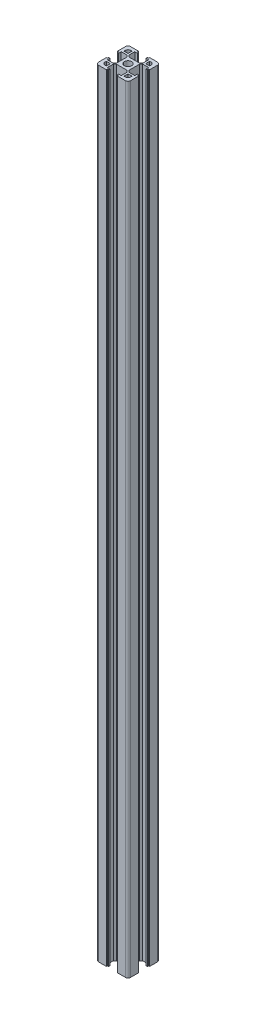
from build123d import *

# Parameters (mm, degrees)
SKETCH_1_R      = 3.4
EXTRUDE_1_DEPTH = 725


with BuildPart() as part:
    # 草图1 → 凸台-拉伸1 (new body)
    with BuildSketch(Plane(origin=(0, 0, 0), x_dir=(1, 0, 0), z_dir=(0, 1, 0))):
        with BuildLine():
            Line((-12.8, 4.1), (-12.8, 6.495575748))
            Line((-12.8, 6.495575748), (-7.273393207, 6.495575748))
            Line((-7.273393207, 6.495575748), (-5.8, 5.022182541))
            Line((-5.8, 5.022182541), (-5.8, 0))
            Line((-5.8, 0), (-5.8, -5.022182541))
            Line((-5.8, -5.022182541), (-7.273393207, -6.495575748))
            Line((-7.273393207, -6.495575748), (-12.8, -6.495575748))
            Line((-12.8, -6.495575748), (-12.8, -4.1))
            Line((-12.8, -4.1), (-14, -4.1))
            Line((-14, -4.1), (-14, -5.2))
            Line((-14, -5.2), (-15, -5.2))
            Line((-15, -5.2), (-15, -12.5))
            ThreePointArc((-15, -12.5), (-14.267766953, -14.267766953), (-12.5, -15))
            Line((-12.5, -15), (-5.2, -15))
            Line((-5.2, -15), (-5.2, -14))
            Line((-5.2, -14), (-4.1, -14))
            Line((-4.1, -14), (-4.1, -12.8))
            Line((-4.1, -12.8), (-6.495575748, -12.8))
            Line((-6.495575748, -12.8), (-6.495575748, -7.273393207))
            Line((-6.495575748, -7.273393207), (-5.022182541, -5.8))
            Line((-5.022182541, -5.8), (0, -5.8))
            Line((0, -5.8), (5.022182541, -5.8))
            Line((5.022182541, -5.8), (6.495575748, -7.273393207))
            Line((6.495575748, -7.273393207), (6.495575748, -12.8))
            Line((6.495575748, -12.8), (4.1, -12.8))
            Line((4.1, -12.8), (4.1, -14))
            Line((4.1, -14), (5.2, -14))
            Line((5.2, -14), (5.2, -15))
            Line((5.2, -15), (12.5, -15))
            ThreePointArc((12.5, -15), (14.267766953, -14.267766953), (15, -12.5))
            Line((15, -12.5), (15, -5.2))
            Line((15, -5.2), (14, -5.2))
            Line((14, -5.2), (14, -4.1))
            Line((14, -4.1), (12.8, -4.1))
            Line((12.8, -4.1), (12.8, -6.495575748))
            Line((12.8, -6.495575748), (7.273393207, -6.495575748))
            Line((7.273393207, -6.495575748), (5.8, -5.022182541))
            Line((5.8, -5.022182541), (5.8, 0))
            Line((5.8, 0), (5.8, 5.022182541))
            Line((5.8, 5.022182541), (7.273393207, 6.495575748))
            Line((7.273393207, 6.495575748), (12.8, 6.495575748))
            Line((12.8, 6.495575748), (12.8, 4.1))
            Line((12.8, 4.1), (14, 4.1))
            Line((14, 4.1), (14, 5.2))
            Line((14, 5.2), (15, 5.2))
            Line((15, 5.2), (15, 12.5))
            ThreePointArc((15, 12.5), (14.267766953, 14.267766953), (12.5, 15))
            Line((12.5, 15), (5.2, 15))
            Line((5.2, 15), (5.2, 14))
            Line((5.2, 14), (4.1, 14))
            Line((4.1, 14), (4.1, 12.8))
            Line((4.1, 12.8), (6.495575748, 12.8))
            Line((6.495575748, 12.8), (6.495575748, 7.273393207))
            Line((6.495575748, 7.273393207), (5.022182541, 5.8))
            Line((5.022182541, 5.8), (0, 5.8))
            Line((0, 5.8), (-5.022182541, 5.8))
            Line((-5.022182541, 5.8), (-6.495575748, 7.273393207))
            Line((-6.495575748, 7.273393207), (-6.495575748, 12.8))
            Line((-6.495575748, 12.8), (-4.1, 12.8))
            Line((-4.1, 12.8), (-4.1, 14))
            Line((-4.1, 14), (-5.2, 14))
            Line((-5.2, 14), (-5.2, 15))
            Line((-5.2, 15), (-12.5, 15))
            ThreePointArc((-12.5, 15), (-14.267766953, 14.267766953), (-15, 12.5))
            Line((-15, 12.5), (-15, 5.2))
            Line((-15, 5.2), (-14, 5.2))
            Line((-14, 5.2), (-14, 4.1))
            Line((-14, 4.1), (-12.8, 4.1))
        make_face()
        with Locations(Location((0, 0, 0), (0, 0, 270))):
            Circle(SKETCH_1_R, mode=Mode.SUBTRACT)
        with BuildLine():
            Line((-12, 9.5), (-12, 8.25))
            Line((-12, 8.25), (-8.25, 8.25))
            Line((-8.25, 8.25), (-8.25, 12))
            Line((-8.25, 12), (-9.5, 12))
            ThreePointArc((-9.5, 12), (-11.267766953, 11.267766953), (-12, 9.5))
        make_face(mode=Mode.SUBTRACT)
        with BuildLine():
            Line((9.5, 12), (8.25, 12))
            Line((8.25, 12), (8.25, 8.25))
            Line((8.25, 8.25), (12, 8.25))
            Line((12, 8.25), (12, 9.5))
            ThreePointArc((12, 9.5), (11.267766953, 11.267766953), (9.5, 12))
        make_face(mode=Mode.SUBTRACT)
        with BuildLine():
            Line((12, -9.5), (12, -8.25))
            Line((12, -8.25), (8.25, -8.25))
            Line((8.25, -8.25), (8.25, -12))
            Line((8.25, -12), (9.5, -12))
            ThreePointArc((9.5, -12), (11.267766953, -11.267766953), (12, -9.5))
        make_face(mode=Mode.SUBTRACT)
        with BuildLine():
            Line((-9.5, -12), (-8.25, -12))
            Line((-8.25, -12), (-8.25, -8.25))
            Line((-8.25, -8.25), (-12, -8.25))
            Line((-12, -8.25), (-12, -9.5))
            ThreePointArc((-12, -9.5), (-11.267766953, -11.267766953), (-9.5, -12))
        make_face(mode=Mode.SUBTRACT)
    extrude(amount=EXTRUDE_1_DEPTH)


solid = part.part
